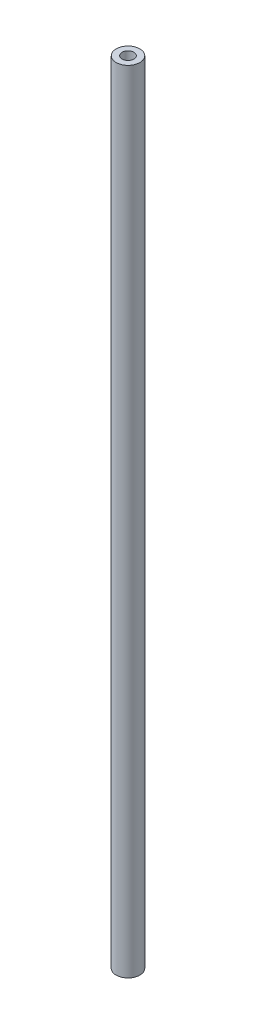
from build123d import *

# Parameters (mm, degrees)
SKETCH_2_R      = 3
SKETCH_2_R_2    = 1.5
EXTRUDE_1_DEPTH = 200


with BuildPart() as part:
    # 草图2 → 凸台-拉伸1 (new body)
    with BuildSketch(Plane(origin=(0, 0, 0), x_dir=(1, 0, 0), z_dir=(0, 1, 0))):
        with Locations(Location((0, 0, 0), (0, 0, 270))):
            Circle(SKETCH_2_R)
        with Locations(Location((0, 0, 0), (0, 0, 270))):
            Circle(SKETCH_2_R_2, mode=Mode.SUBTRACT)
    extrude(amount=EXTRUDE_1_DEPTH)


solid = part.part
